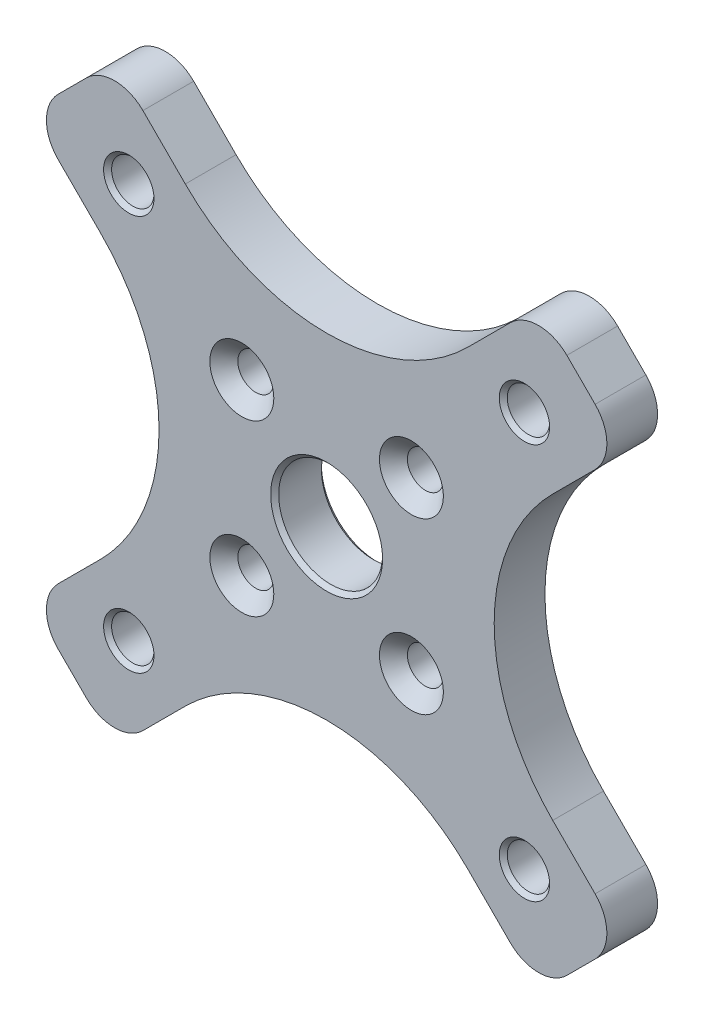
from build123d import *

# Parameters (mm, degrees)
SKETCH1_R                      = 6.5
F_1_4_IN_SHEET_METAL_DEPTH     = 3.175
M4_CLEARANCE_HOLE1_D           = 4.5
M4_CLEARANCE_HOLE1_CSINK_D     = 8
M4_CLEARANCE_HOLE1_CSINK_ANGLE = 90
M5_CLEARANCE_HOLE1_D           = 5.3
F_25_MM_FILLET_R               = 25
F_5_MM_FILLET_R                = 5
F_0_50_MM_CHAMFER_SIZE         = 0.5


with BuildPart() as part:
    # Sketch1 → 1/4 in Sheet Metal (new, symmetric)
    with BuildSketch(Plane.XY):
        Polygon((0, 10.606601718), (26.516504294, 37.123106012), (37.123106012, 26.516504294), (10.606601718, 0), (37.123106012, -26.516504294), (26.516504294, -37.123106012), (0, -10.606601718), (-26.516504294, -37.123106012), (-37.123106012, -26.516504294), (-10.606601718, 0), (-37.123106012, 26.516504294), (-26.516504294, 37.123106012), align=None)
        Circle(SKETCH1_R, mode=Mode.SUBTRACT)
    extrude(amount=F_1_4_IN_SHEET_METAL_DEPTH, both=True)

    # M4 Clearance Hole1 (through all)
    with Locations(Plane.XY.offset(3.175)):
        with Locations((-10.606601718, 10.606601718), (10.606601718, 10.606601718), (10.606601718, -10.606601718), (-10.606601718, -10.606601718)):
            CounterSinkHole(M4_CLEARANCE_HOLE1_D / 2, M4_CLEARANCE_HOLE1_CSINK_D / 2, counter_sink_angle=M4_CLEARANCE_HOLE1_CSINK_ANGLE)

    # M5 Clearance Hole1 (through all)
    with Locations(Plane(origin=(0, 0, -3.175), x_dir=(-1, 0, 0), z_dir=(0, 0, -1))):
        with Locations((-24.748737342, 24.748737342), (24.748737342, 24.748737342), (24.748737342, -24.748737342), (-24.748737342, -24.748737342)):
            Hole(M5_CLEARANCE_HOLE1_D / 2)

    # 25 mm Fillet
    f_25_mm_fillet_edges = [part.edges().sort_by_distance(p)[0] for p in [
        (0, 10.606601718, 0),
        (10.606601718, 0, 0),
        (0, -10.606601718, 0),
        (-10.606601718, 0, 0),
    ]]
    fillet(f_25_mm_fillet_edges, radius=F_25_MM_FILLET_R)

    # 5 mm Fillet
    f_5_mm_fillet_edges = [part.edges().sort_by_distance(p)[0] for p in [
        (26.516504294, 37.123106012, 0),
        (37.123106012, 26.516504294, 0),
        (37.123106012, -26.516504294, 0),
        (26.516504294, -37.123106012, 0),
        (-26.516504294, -37.123106012, 0),
        (-37.123106012, -26.516504294, 0),
        (-37.123106012, 26.516504294, 0),
        (-26.516504294, 37.123106012, 0),
    ]]
    fillet(f_5_mm_fillet_edges, radius=F_5_MM_FILLET_R)

    # 0.50 mm Chamfer
    f_0_50_mm_chamfer_edges = [part.edges().sort_by_distance(p)[0] for p in [
        (-6.5, 0, -3.175),
        (-6.5, 0, 3.175),
        (22.098737342, -24.748737342, -3.175),
        (22.098737342, -24.748737342, 3.175),
        (-27.398737342, -24.748737342, -3.175),
        (-27.398737342, -24.748737342, 3.175),
        (-27.398737342, 24.748737342, -3.175),
        (-27.398737342, 24.748737342, 3.175),
        (22.098737342, 24.748737342, -3.175),
        (22.098737342, 24.748737342, 3.175),
    ]]
    chamfer(f_0_50_mm_chamfer_edges, length=F_0_50_MM_CHAMFER_SIZE)


solid = part.part
